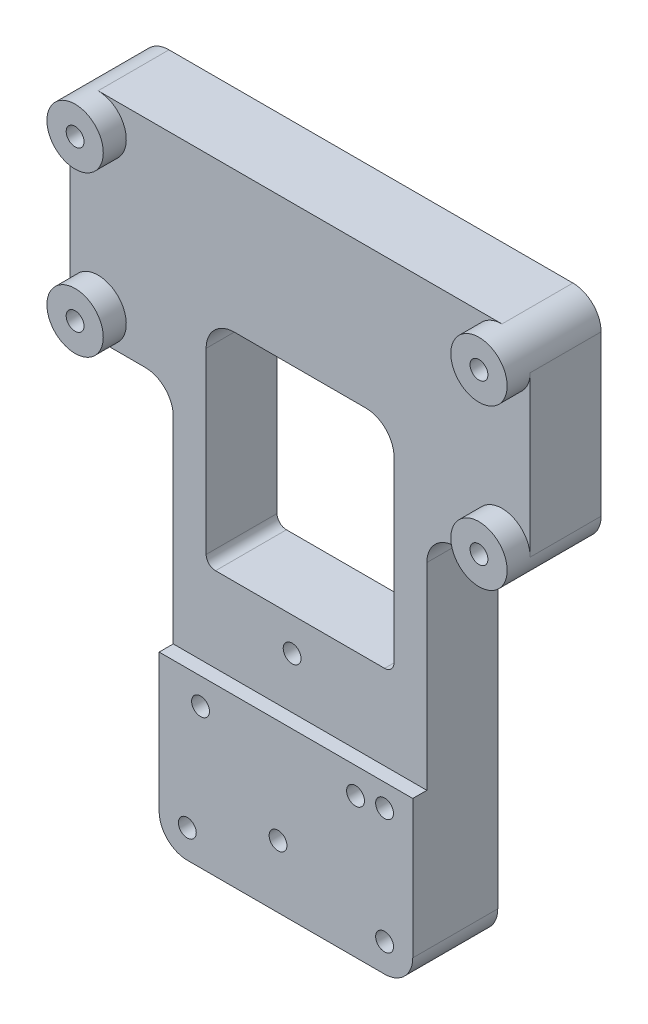
from build123d import *

# Parameters (mm, degrees)
BOSS_EXTRUDE1_DEPTH = 9.05
SKETCH2_W           = 20
SKETCH2_H           = 10
CUT_EXTRUDE1_DEPTH  = 57.605743
FILLET1_R           = 3
SKETCH4_R           = 3
BOSS_EXTRUDE2_DEPTH = 0.95
CUT_EXTRUDE2_START  = -1.5
CUT_EXTRUDE2_DEPTH  = 1.5
SKETCH5_R           = 0.95
CUT_EXTRUDE3_DEPTH  = 57.765374


with BuildPart() as part:
    # Sketch1 → Boss-Extrude1 (new body)
    with BuildSketch(Plane.XY):
        with BuildLine():
            Line((-23.657, 29.8), (-23.657, 46.8))
            ThreePointArc((-23.657, 46.8), (-22.77832, 48.92132), (-20.657, 49.8))
            Line((-20.657, 49.8), (22.343, 49.8))
            ThreePointArc((22.343, 49.8), (24.46432, 48.92132), (25.343, 46.8))
            Line((25.343, 46.8), (25.343, 29.8))
            ThreePointArc((25.343, 29.8), (24.46432, 27.67868), (22.343, 26.8))
            Line((22.343, 26.8), (17.343, 26.8))
            ThreePointArc((17.343, 26.8), (15.22168, 25.92132), (14.343, 23.8))
            Line((14.343, 23.8), (14.343, -11.9))
            ThreePointArc((14.343, -11.9), (13.46432, -14.02132), (11.343, -14.9))
            Line((11.343, -14.9), (-9.657, -14.9))
            ThreePointArc((-9.657, -14.9), (-11.77832, -14.02132), (-12.657, -11.9))
            Line((-12.657, -11.9), (-12.657, 23.8))
            ThreePointArc((-12.657, 23.8), (-13.53568, 25.92132), (-15.657, 26.8))
            Line((-15.657, 26.8), (-20.657, 26.8))
            ThreePointArc((-20.657, 26.8), (-22.77832, 27.67868), (-23.657, 29.8))
        make_face()
    extrude(amount=BOSS_EXTRUDE1_DEPTH)

    # Sketch2 → Cut-Extrude1 (cut, through all)
    with BuildSketch(Plane.XY.offset(9.05)):
        with BuildLine():
            Line((-8.157, 11.8), (9.843, 11.8))
            ThreePointArc((9.843, 11.8), (10.550107, 12.092893), (10.843, 12.8))
            Line((10.843, 12.8), (10.843, 24.8))
            Line((10.843, 24.8), (-9.157, 24.8))
            Line((-9.157, 24.8), (-9.157, 12.8))
            ThreePointArc((-9.157, 12.8), (-8.864107, 12.092893), (-8.157, 11.8))
        make_face()
        with Locations((0.843, 29.8)):
            Rectangle(SKETCH2_W, SKETCH2_H)
    extrude(amount=-CUT_EXTRUDE1_DEPTH, mode=Mode.SUBTRACT)

    # Fillet1
    fillet1_edges = [part.edges().sort_by_distance(p)[0] for p in [
        (-9.157, 34.8, 4.525),
        (10.843, 34.8, 4.525),
    ]]
    fillet(fillet1_edges, radius=FILLET1_R)

    # Sketch4 → Boss-Extrude2 (add)
    with BuildSketch(Plane.XY.offset(9.05)):
        with Locations((22.343, 29.8)):
            Circle(SKETCH4_R)
        with Locations((22.343, 46.8)):
            Circle(SKETCH4_R)
        with Locations(Location((-20.657, 46.8, 0), (0, 0, 180))):
            Circle(SKETCH4_R)
        with Locations(Location((-20.657, 29.8, 0), (0, 0, 180))):
            Circle(SKETCH4_R)
    extrude(amount=BOSS_EXTRUDE2_DEPTH)

    # Sketch3 → Cut-Extrude2 (cut)
    with BuildSketch(Plane.XY.offset(9.05).offset(CUT_EXTRUDE2_START)):
        with BuildLine():
            Line((-12.657, 2.8), (14.343, 2.8))
            Line((14.343, 2.8), (14.343, 23.8))
            ThreePointArc((14.343, 23.8), (15.22168, 25.92132), (17.343, 26.8))
            Line((17.343, 26.8), (22.343, 26.8))
            ThreePointArc((22.343, 26.8), (20.22168, 31.92132), (25.343, 29.8))
            Line((25.343, 29.8), (25.343, 46.8))
            ThreePointArc((25.343, 46.8), (20.22168, 44.67868), (22.343, 49.8))
            Line((22.343, 49.8), (-20.657, 49.8))
            ThreePointArc((-20.657, 49.8), (-18.53568, 44.67868), (-23.657, 46.8))
            Line((-23.657, 46.8), (-23.657, 29.8))
            ThreePointArc((-23.657, 29.8), (-18.53568, 31.92132), (-20.657, 26.8))
            Line((-20.657, 26.8), (-15.657, 26.8))
            ThreePointArc((-15.657, 26.8), (-13.53568, 25.92132), (-12.657, 23.8))
            Line((-12.657, 23.8), (-12.657, 2.8))
        make_face()
        with BuildLine():
            Line((10.843, 31.8), (10.843, 12.8))
            ThreePointArc((10.843, 12.8), (10.550107, 12.092893), (9.843, 11.8))
            Line((9.843, 11.8), (-8.157, 11.8))
            ThreePointArc((-8.157, 11.8), (-8.864107, 12.092893), (-9.157, 12.8))
            Line((-9.157, 12.8), (-9.157, 31.8))
            ThreePointArc((-9.157, 31.8), (-8.27832, 33.92132), (-6.157, 34.8))
            Line((-6.157, 34.8), (7.843, 34.8))
            ThreePointArc((7.843, 34.8), (9.96432, 33.92132), (10.843, 31.8))
        make_face(mode=Mode.SUBTRACT)
    extrude(amount=CUT_EXTRUDE2_DEPTH, mode=Mode.SUBTRACT)

    # Sketch5 → Cut-Extrude3 (cut, through all)
    with BuildSketch(Plane.XY.offset(10)):
        with Locations((22.343, 46.8)):
            Circle(SKETCH5_R)
        with Locations((22.343, 29.8)):
            Circle(SKETCH5_R)
        with Locations((-20.657, 46.8)):
            Circle(SKETCH5_R)
        with Locations((-20.657, 29.8)):
            Circle(SKETCH5_R)
        with Locations((-9.657, -11.9)):
            Circle(SKETCH5_R)
        with Locations((11.343, -11.9)):
            Circle(SKETCH5_R)
        with Locations((11.343, 0.4)):
            Circle(SKETCH5_R)
        with Locations((0, 8.25)):
            Circle(SKETCH5_R)
        with Locations((-8.25, 0)):
            Circle(SKETCH5_R)
        with Locations((8.25, 0)):
            Circle(SKETCH5_R)
        with Locations((0, -8.25)):
            Circle(SKETCH5_R)
    extrude(amount=-CUT_EXTRUDE3_DEPTH, mode=Mode.SUBTRACT)


solid = part.part
